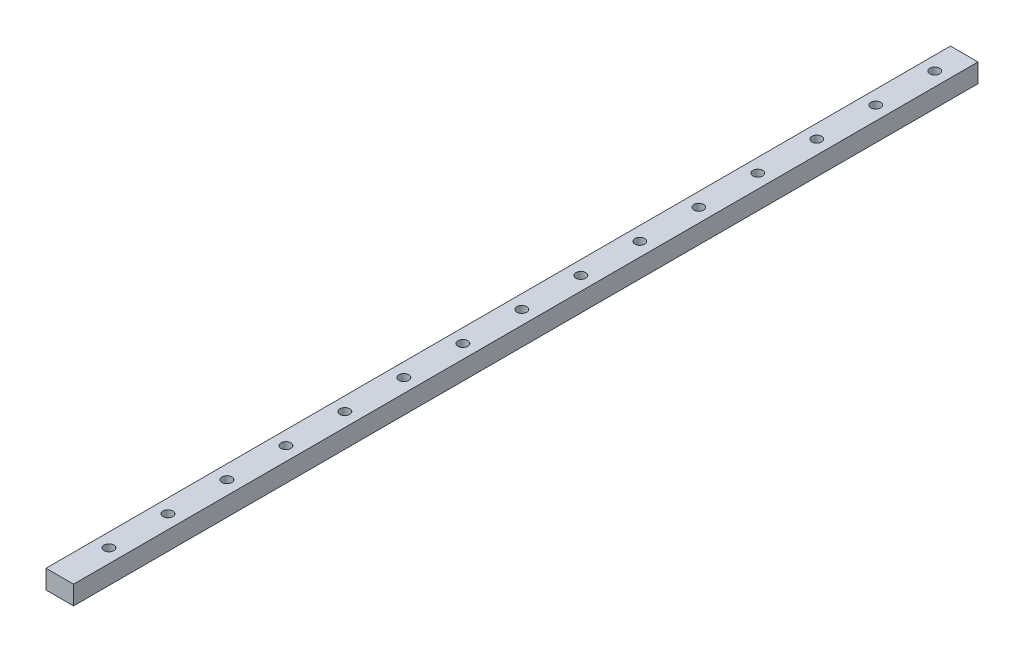
from build123d import *

# Parameters (mm, degrees)
SKETCH_1_W      = 7
SKETCH_1_H      = 230
SKETCH_1_R      = 1.25
EXTRUDE_1_DEPTH = 4.8


with BuildPart() as part:
    # 草图1 → 凸台-拉伸1 (new body)
    with BuildSketch(Plane(origin=(0, 0, 0), x_dir=(1, 0, 0), z_dir=(0, 1, 0))):
        Rectangle(SKETCH_1_W, SKETCH_1_H)
        with Locations(Location((0, 107.5, 0), (0, 0, 270))):
            Circle(SKETCH_1_R, mode=Mode.SUBTRACT)
        with Locations(Location((0, 92.5, 0), (0, 0, 270))):
            Circle(SKETCH_1_R, mode=Mode.SUBTRACT)
        with Locations(Location((0, 77.5, 0), (0, 0, 270))):
            Circle(SKETCH_1_R, mode=Mode.SUBTRACT)
        with Locations(Location((0, 62.5, 0), (0, 0, 270))):
            Circle(SKETCH_1_R, mode=Mode.SUBTRACT)
        with Locations(Location((0, 47.5, 0), (0, 0, 270))):
            Circle(SKETCH_1_R, mode=Mode.SUBTRACT)
        with Locations(Location((0, 32.5, 0), (0, 0, 270))):
            Circle(SKETCH_1_R, mode=Mode.SUBTRACT)
        with Locations(Location((0, 17.5, 0), (0, 0, 270))):
            Circle(SKETCH_1_R, mode=Mode.SUBTRACT)
        with Locations(Location((0, 2.5, 0), (0, 0, 270))):
            Circle(SKETCH_1_R, mode=Mode.SUBTRACT)
        with Locations(Location((0, -12.5, 0), (0, 0, 270))):
            Circle(SKETCH_1_R, mode=Mode.SUBTRACT)
        with Locations(Location((0, -27.5, 0), (0, 0, 270))):
            Circle(SKETCH_1_R, mode=Mode.SUBTRACT)
        with Locations(Location((0, -42.5, 0), (0, 0, 270))):
            Circle(SKETCH_1_R, mode=Mode.SUBTRACT)
        with Locations(Location((0, -57.5, 0), (0, 0, 270))):
            Circle(SKETCH_1_R, mode=Mode.SUBTRACT)
        with Locations(Location((0, -72.5, 0), (0, 0, 270))):
            Circle(SKETCH_1_R, mode=Mode.SUBTRACT)
        with Locations(Location((0, -87.5, 0), (0, 0, 270))):
            Circle(SKETCH_1_R, mode=Mode.SUBTRACT)
        with Locations(Location((0, -102.5, 0), (0, 0, 270))):
            Circle(SKETCH_1_R, mode=Mode.SUBTRACT)
    extrude(amount=EXTRUDE_1_DEPTH)


solid = part.part
